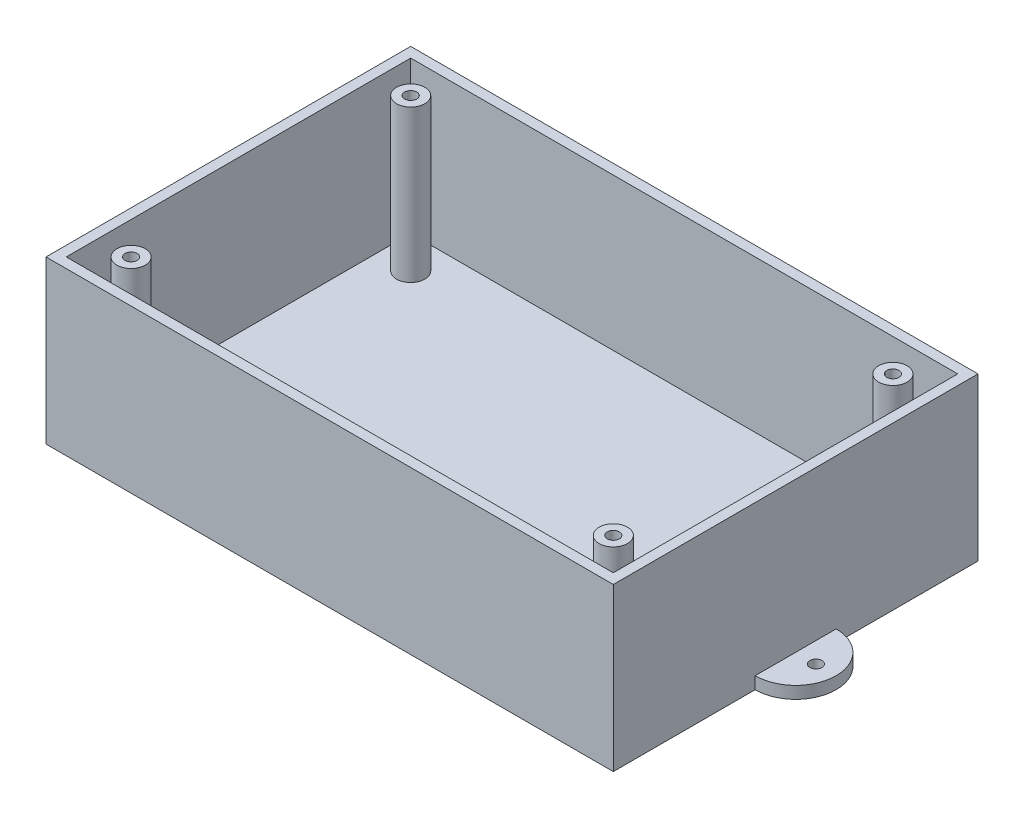
from build123d import *

# Parameters (mm, degrees)
SKETCH1_W           = 140
SKETCH1_H           = 90
BOSS_EXTRUDE1_DEPTH = 40
SKETCH2_W           = 135
SKETCH2_H           = 85
CUT_EXTRUDE1_DEPTH  = 37.5
SKETCH3_R           = 3.5
BOSS_EXTRUDE2_DEPTH = 37.5
SKETCH4_R           = 1.5
CUT_EXTRUDE2_DEPTH  = 37.5
BOSS_EXTRUDE3_DEPTH = 3
SKETCH7_R           = 1.5
CUT_EXTRUDE3_DEPTH  = 180.443584449


with BuildPart() as part:
    # Sketch1 → Boss-Extrude1 (new body)
    with BuildSketch(Plane(origin=(0, 0, 0), x_dir=(1, 0, 0), z_dir=(0, 1, 0))):
        with Locations((70, 45)):
            Rectangle(SKETCH1_W, SKETCH1_H)
    extrude(amount=BOSS_EXTRUDE1_DEPTH)

    # Sketch2 → Cut-Extrude1 (cut)
    with BuildSketch(Plane(origin=(0, 40, 0), x_dir=(1, 0, 0), z_dir=(0, 1, 0))):
        with Locations((70, 45)):
            Rectangle(SKETCH2_W, SKETCH2_H)
    extrude(amount=-CUT_EXTRUDE1_DEPTH, mode=Mode.SUBTRACT)

    # Sketch3 → Boss-Extrude2 (add)
    with BuildSketch(Plane(origin=(0, 2.5, 0), x_dir=(1, 0, 0), z_dir=(0, 1, 0))):
        with Locations(Location((10.5, 79.5, 0), (0, 0, 270))):
            Circle(SKETCH3_R)
        with Locations(Location((10.5, 10.5, 0), (0, 0, 270))):
            Circle(SKETCH3_R)
        with Locations(Location((129.5, 10.5, 0), (0, 0, 270))):
            Circle(SKETCH3_R)
        with Locations(Location((129.5, 79.5, 0), (0, 0, 270))):
            Circle(SKETCH3_R)
    extrude(amount=BOSS_EXTRUDE2_DEPTH)

    # Sketch4 → Cut-Extrude2 (cut)
    with BuildSketch(Plane(origin=(0, 40, 0), x_dir=(1, 0, 0), z_dir=(0, 1, 0))):
        with Locations(Location((10.5, 79.5, 0), (0, 0, 270))):
            Circle(SKETCH4_R)
        with Locations(Location((129.5, 79.5, 0), (0, 0, 270))):
            Circle(SKETCH4_R)
        with Locations(Location((10.5, 10.5, 0), (0, 0, 270))):
            Circle(SKETCH4_R)
        with Locations(Location((129.5, 10.5, 0), (0, 0, 270))):
            Circle(SKETCH4_R)
    extrude(amount=-CUT_EXTRUDE2_DEPTH, mode=Mode.SUBTRACT)

    # Sketch5 → Boss-Extrude3 (add)
    with BuildSketch(Plane.XZ):
        with BuildLine():
            ThreePointArc((0, -35), (-7.071067812, -37.928932188), (-10, -45))
            Line((-10, -45), (0, -45))
            Line((0, -45), (0, -35))
        make_face()
        with BuildLine():
            Line((0, -45), (-10, -45))
            ThreePointArc((-10, -45), (-7.071067812, -52.071067812), (0, -55))
            Line((0, -55), (0, -45))
        make_face()
        with BuildLine():
            Line((140, -35), (140, -45))
            Line((140, -45), (150, -45))
            ThreePointArc((150, -45), (147.071067812, -37.928932188), (140, -35))
        make_face()
        with BuildLine():
            Line((150, -45), (140, -45))
            Line((140, -45), (140, -55))
            ThreePointArc((140, -55), (147.071067812, -52.071067812), (150, -45))
        make_face()
    extrude(amount=-BOSS_EXTRUDE3_DEPTH)

    # Sketch7 → Cut-Extrude3 (cut, through all)
    with BuildSketch(Plane.XZ):
        with Locations(Location((-5, -45, 0), (0, 0, 270))):
            Circle(SKETCH7_R)
        with Locations(Location((145, -45, 0), (0, 0, 270))):
            Circle(SKETCH7_R)
    extrude(amount=-CUT_EXTRUDE3_DEPTH, mode=Mode.SUBTRACT)


solid = part.part
